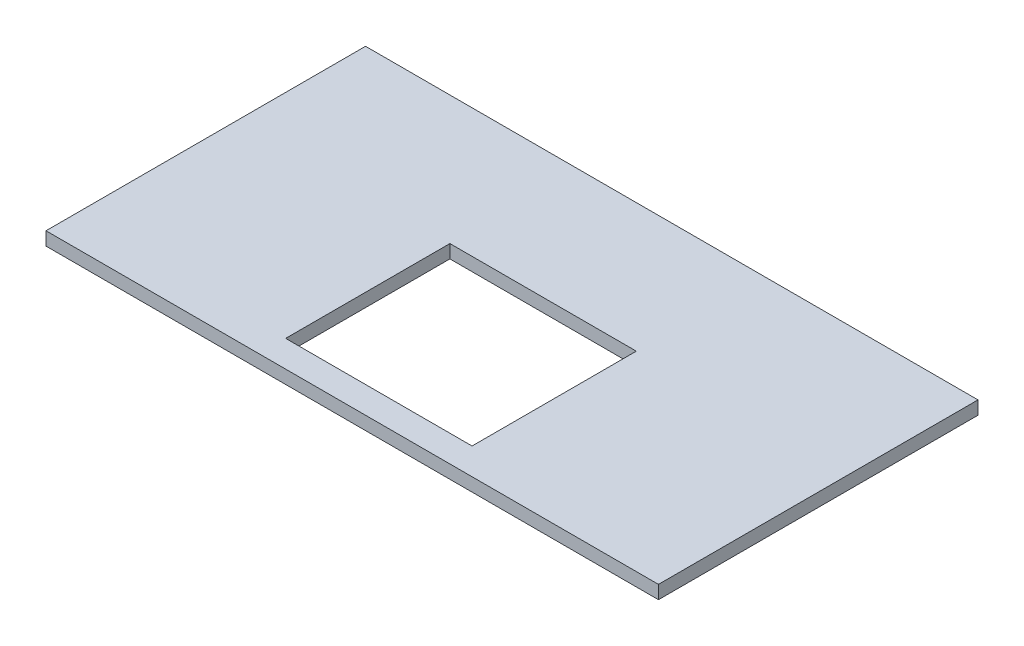
from build123d import *

# Parameters (mm, degrees)
SKETCH1_W           = 146.05
SKETCH1_H           = 76.2
SKETCH1_W_2         = 44.45
SKETCH1_H_2         = 39.1668
BOSS_EXTRUDE1_DEPTH = 3.175


with BuildPart() as part:
    # Sketch1 → Boss-Extrude1 (new body)
    with BuildSketch(Plane(origin=(0, 0, 0), x_dir=(1, 0, 0), z_dir=(0, 1, 0))):
        with Locations((73.025, 38.1)):
            Rectangle(SKETCH1_W, SKETCH1_H)
        with Locations((73.025, 25.9334)):
            Rectangle(SKETCH1_W_2, SKETCH1_H_2, mode=Mode.SUBTRACT)
    extrude(amount=BOSS_EXTRUDE1_DEPTH)


solid = part.part
